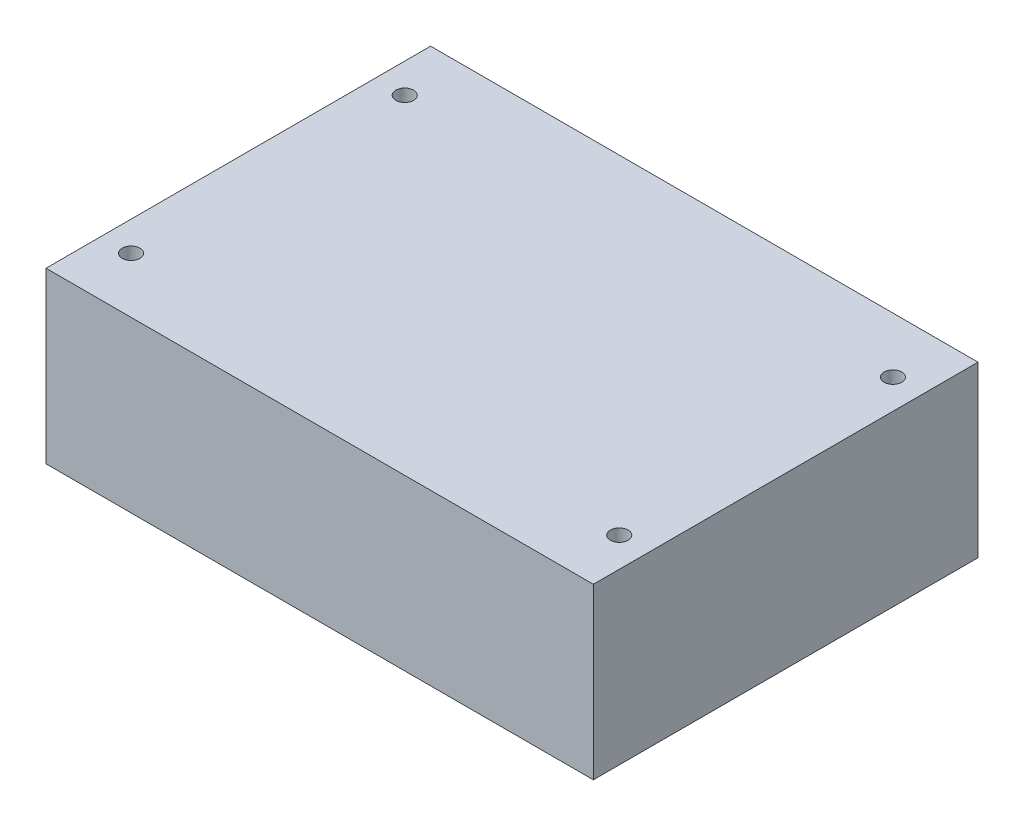
from build123d import *

# Parameters (mm, degrees)
CROQUIS1_W                       = 74
CROQUIS1_H                       = 52
SALIENTE_EXTRUIR1_DEPTH          = 22.9
TALADRO_DE_MARGEN_PARA_M21_D     = 2.4
TALADRO_DE_MARGEN_PARA_M21_DEPTH = 2.5
TALADRO_DE_MARGEN_PARA_M21_TIP   = 0.721032743


with BuildPart() as part:
    # Croquis1 → Saliente-Extruir1 (new body)
    with BuildSketch(Plane(origin=(0, 11, 0), x_dir=(1, 0, 0), z_dir=(0, 1, 0))):
        with Locations((100.989943512, 73.534095957)):
            Rectangle(CROQUIS1_W, CROQUIS1_H)
    extrude(amount=SALIENTE_EXTRUIR1_DEPTH)

    # Taladro de margen para M21
    with Locations(Plane(origin=(0, 33.9, 0), x_dir=(1, 0, 0), z_dir=(0, 1, 0))):
        with Locations((67.989943512, 92.034095957), (133.989943512, 92.034095957), (133.989943512, 55.034095957), (67.989943512, 55.034095957)):
            Hole(TALADRO_DE_MARGEN_PARA_M21_D / 2, depth=TALADRO_DE_MARGEN_PARA_M21_DEPTH)
            with Locations((0, 0, -(TALADRO_DE_MARGEN_PARA_M21_DEPTH + TALADRO_DE_MARGEN_PARA_M21_TIP / 2))):  # 118° drill point
                Cone(0, TALADRO_DE_MARGEN_PARA_M21_D / 2, TALADRO_DE_MARGEN_PARA_M21_TIP, mode=Mode.SUBTRACT)


solid = part.part
